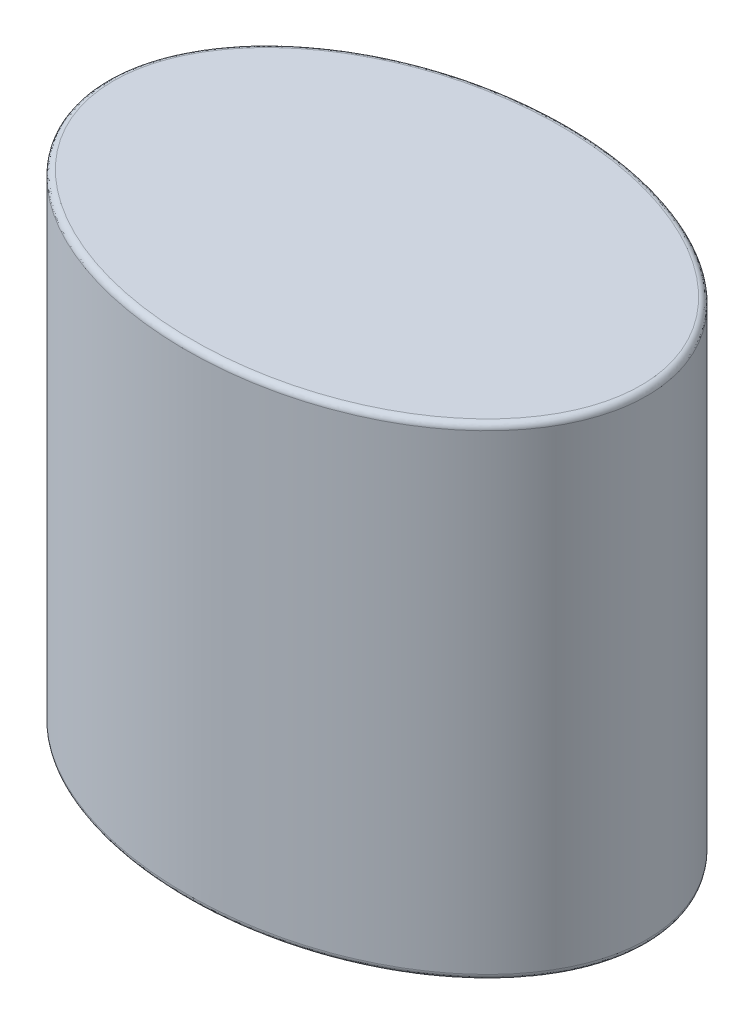
from build123d import *

# Parameters (mm, degrees)
BOSS_EXTRUDE1_DEPTH = 40
FILLET1_R           = 0.5


with BuildPart() as part:
    # Sketch1 → Boss-Extrude1 (new body)
    with BuildSketch(Plane(origin=(0, 0, 0), x_dir=(-1, 0, 0), z_dir=(0, 1, 0))):
        with BuildLine():
            add(Edge.make_bspline(
                [(-22.345138644, -0.004843186), (-22.345230404, 0.331636477), (-22.314647837, 1.006296553), (-22.176659983, 2.014079109), (-21.946747683, 3.01504213), (-21.625340233, 4.005598838), (-21.213129904, 4.98200215), (-20.711138961, 5.940342352), (-20.120780291, 6.876571849), (-19.443903395, 7.786550139), (-18.682821941, 8.666100438), (-17.840322981, 9.511069953), (-16.919660495, 10.317387749), (-15.924537053, 11.08111655), (-14.859077382, 11.798496812), (-13.727797052, 12.465982925), (-12.535568661, 13.080272233), (-11.287587102, 13.638327943), (-9.989334874, 14.137397073), (-8.646547914, 14.57502448), (-7.26518214, 14.949063822), (-5.851380715, 15.257686113), (-4.411441952, 15.499386378), (-2.951787729, 15.672988738), (-1.478932307, 15.777650181), (0.000548577, 15.812863158), (1.480048447, 15.778457118), (2.952960733, 15.674599008), (4.412709425, 15.501792792), (5.852779801, 15.260877928), (7.266749343, 14.953026792), (8.648318918, 14.579740923), (9.991344367, 14.142845958), (11.289868602, 13.644484989), (12.538154348, 13.087110031), (13.730717604, 12.473471074), (14.862361823, 11.806602077), (15.928212606, 11.089803041), (16.923752449, 10.326617109), (17.844854576, 9.520801576), (18.687814271, 8.676291699), (19.449375331, 7.797156635), (20.126748442, 6.88754766), (20.717617659, 5.951640293), (21.220131221, 4.993574027), (21.632874033, 4.017395687), (21.954821701, 3.027014426), (22.185279907, 2.026176952), (22.323817401, 1.018469806), (22.37020438, 0.007351033), (22.324368888, -1.00379289), (22.186381033, -2.011575446), (21.956468734, -3.012538467), (21.635061283, -4.003095176), (21.222850955, -4.979498487), (20.720860012, -5.937838689), (20.130501341, -6.874068186), (19.453624445, -7.784046476), (18.692542992, -8.663596776), (17.850044032, -9.50856629), (16.929381546, -10.314884087), (15.934258104, -11.078612888), (14.868798432, -11.795993149), (13.737518103, -12.463479263), (12.545289712, -13.077768571), (11.297308153, -13.63582428), (9.999055925, -14.13489341), (8.656268964, -14.572520817), (7.27490319, -14.946560159), (5.861101766, -15.255182451), (4.421163002, -15.496882715), (2.961508779, -15.670485075), (1.488653358, -15.775146518), (0.009172473, -15.810359496), (-1.470327396, -15.775953455), (-2.943239683, -15.672095346), (-4.402988374, -15.499289129), (-5.843058751, -15.258374265), (-7.257028292, -14.950523129), (-8.638597868, -14.577237261), (-9.981623317, -14.140342295), (-11.280147552, -13.641981326), (-12.528433297, -13.084606368), (-13.720996554, -12.470967411), (-14.852640772, -11.804098415), (-15.918491555, -11.087299378), (-16.914031399, -10.324113446), (-17.835133526, -9.518297913), (-18.67809322, -8.673788036), (-19.43965428, -7.794652973), (-20.117027392, -6.885043998), (-20.707896609, -5.94913663), (-21.21041017, -4.991070364), (-21.623152983, -4.014892024), (-21.945100651, -3.024510763), (-22.175558856, -2.023673289), (-22.314096351, -1.015966144), (-22.345046883, -0.341322848), (-22.345138644, -0.004843186)],
                knots=[0, 0, 0, 0, 0.008362351, 0.016766762, 0.025253882, 0.03386167, 0.042624326, 0.051571508, 0.060727841, 0.070112682, 0.079740117, 0.089619108, 0.099753761, 0.110143656, 0.120784214, 0.131667077, 0.142780486, 0.154109643, 0.165637074, 0.177342957, 0.189205456, 0.201201025, 0.213304716, 0.225490462, 0.237731372, 0.25, 0.262268628, 0.274509538, 0.286695284, 0.298798975, 0.310794544, 0.322657043, 0.334362926, 0.345890357, 0.357219514, 0.368332923, 0.379215786, 0.389856344, 0.400246239, 0.410380892, 0.420259883, 0.429887318, 0.439272159, 0.448428492, 0.457375674, 0.46613833, 0.474746118, 0.483233238, 0.491637649, 0.5, 0.508362351, 0.516766762, 0.525253882, 0.53386167, 0.542624326, 0.551571508, 0.560727841, 0.570112682, 0.579740117, 0.589619108, 0.599753761, 0.610143656, 0.620784214, 0.631667077, 0.642780486, 0.654109643, 0.665637074, 0.677342957, 0.689205456, 0.701201025, 0.713304716, 0.725490462, 0.737731372, 0.75, 0.762268628, 0.774509538, 0.786695284, 0.798798975, 0.810794544, 0.822657043, 0.834362926, 0.845890357, 0.857219514, 0.868332923, 0.879215786, 0.889856344, 0.900246239, 0.910380892, 0.920259883, 0.929887318, 0.939272159, 0.948428492, 0.957375674, 0.96613833, 0.974746118, 0.983233238, 0.991637649, 1, 1, 1, 1], degree=3))
        make_face()
    extrude(amount=BOSS_EXTRUDE1_DEPTH)

    # Fillet1
    fillet1_edges = [part.edges().sort_by_distance(p)[0] for p in [
        (-22.354859694, 0, 0.007346848),
        (-22.354859694, 40, 0.007346848),
    ]]
    fillet(fillet1_edges, radius=FILLET1_R)


solid = part.part
